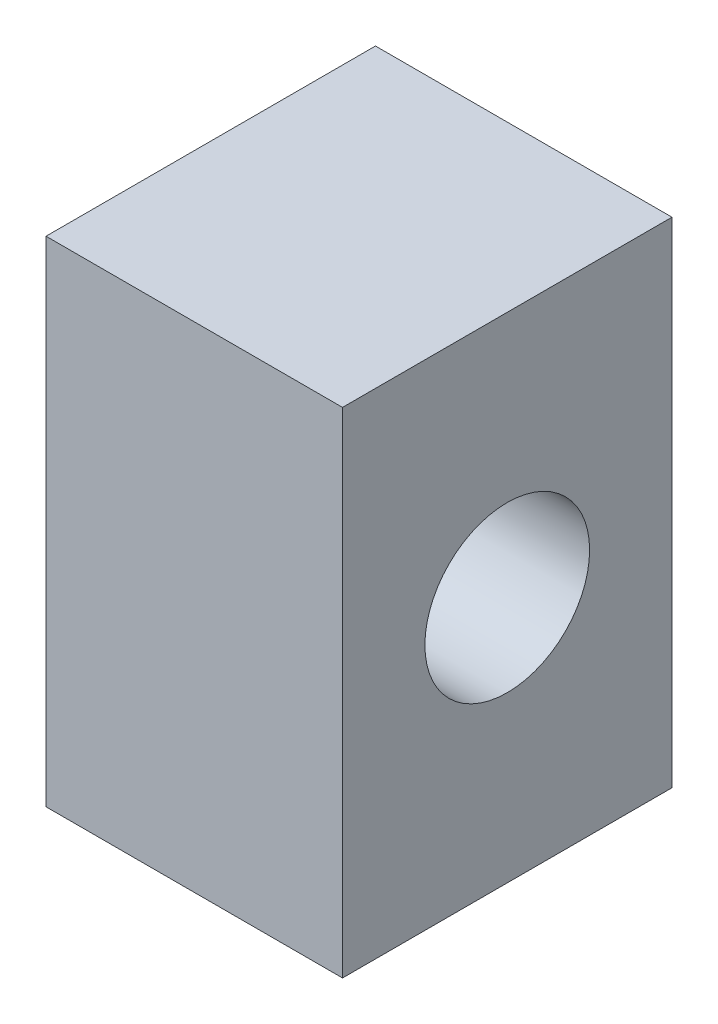
from build123d import *

# Parameters (mm, degrees)
SKETCH1_W           = 22.86
SKETCH1_H           = 25.4
BOSS_EXTRUDE1_DEPTH = 38.1
SKETCH2_R           = 6.35
CUT_EXTRUDE1_DEPTH  = 47.211249713


with BuildPart() as part:
    # Sketch1 → Boss-Extrude1 (new body)
    with BuildSketch(Plane(origin=(0, 0, 0), x_dir=(1, 0, 0), z_dir=(0, 1, 0))):
        Rectangle(SKETCH1_W, SKETCH1_H)
    extrude(amount=BOSS_EXTRUDE1_DEPTH)

    # Sketch2 → Cut-Extrude1 (cut, through all)
    with BuildSketch(Plane(origin=(11.43, 0, 0), x_dir=(0, 0, -1), z_dir=(1, 0, 0))):
        with Locations((0, 19.05)):
            Circle(SKETCH2_R)
    extrude(amount=-CUT_EXTRUDE1_DEPTH, mode=Mode.SUBTRACT)


solid = part.part
